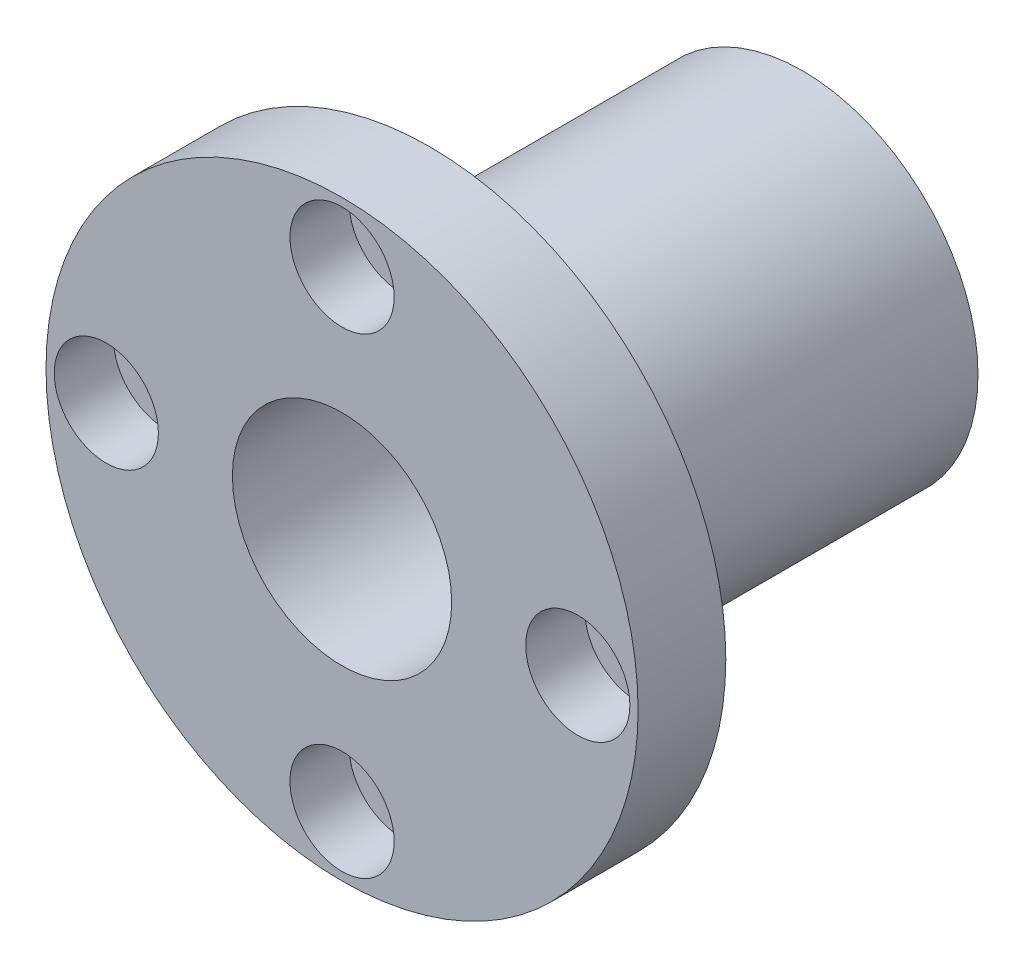
from build123d import *

# Parameters (mm, degrees)
HOLE_WIZARD_1_D           = 5.5
HOLE_WIZARD_1_CBORE_D     = 9.5
HOLE_WIZARD_1_CBORE_DEPTH = 5.4


with BuildPart() as part:
    # 草图1 → 旋转1 (revolve)
    with BuildSketch(Plane(origin=(0, 0, 0), x_dir=(0, 0, 1), z_dir=(0, -1, 0))):
        Polygon((0, 10), (42, 10), (42, 27), (34, 27), (34, 16), (0, 16), align=None)
    revolve(axis=Axis((0, 0, 0), (0, 0, 1)))

    # 孔1 (through all)
    with Locations(Plane.XY.offset(42)):
        with Locations((0, -21.5), (-21.5, 0), (0, 21.5), (21.5, 0)):
            CounterBoreHole(HOLE_WIZARD_1_D / 2, HOLE_WIZARD_1_CBORE_D / 2, HOLE_WIZARD_1_CBORE_DEPTH)


solid = part.part
